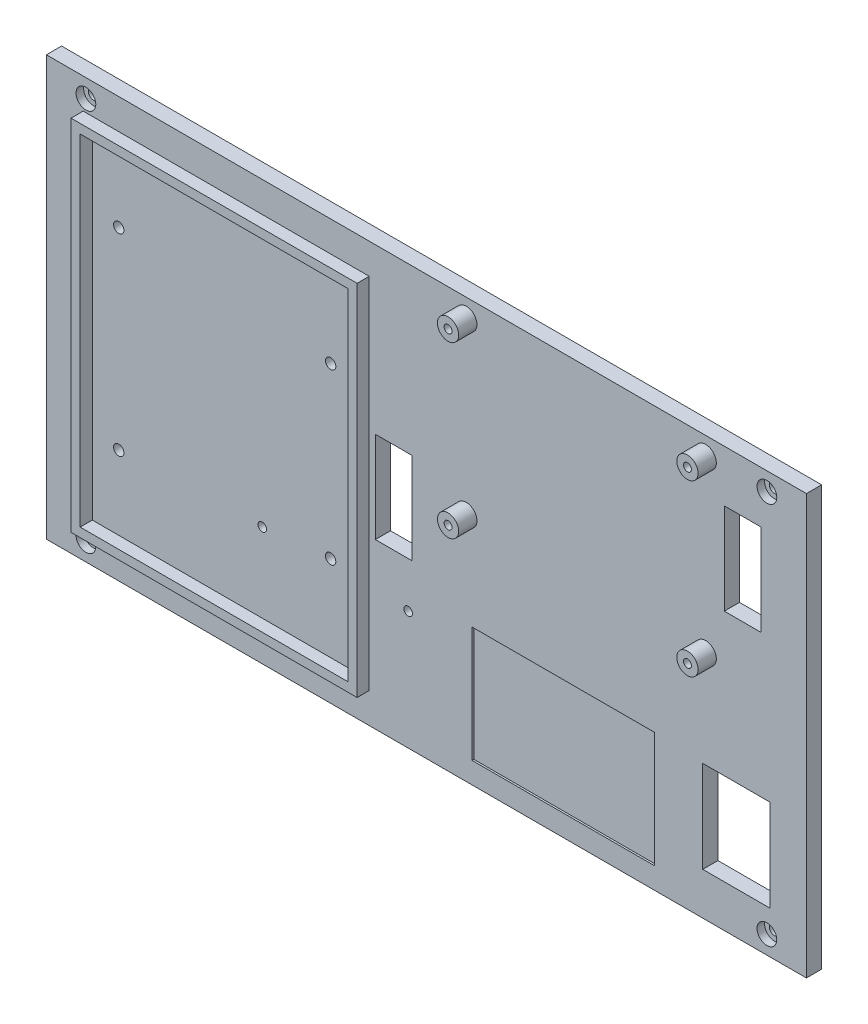
from build123d import *

# Parameters (mm, degrees)
SKETCH1_W                       = 250
SKETCH1_H                       = 138
PLATE_DEPTH                     = 5
SKETCH2_W                       = 94.1
SKETCH2_H                       = 118
SKETCH2_W_2                     = 88.1
SKETCH2_H_2                     = 112
ARM_LOCATING_FENCE_DEPTH        = 4
SKETCH3_R                       = 1.7
ARM_M3_HOLES_DEPTH              = 7
SKETCH4_R                       = 1.7
DECK_M3_HOLES_DEPTH             = 7
SKETCH5_R                       = 3.25
DECK_COUNTERBORES_DEPTH         = 2.5
SKETCH6_W                       = 22.2
SKETCH6_H                       = 30.2
KILL_SWITCH_CUTOUT_DEPTH        = 7
SKETCH7_W                       = 12
SKETCH7_H                       = 30
SERVO_CABLE_SLOT_DEPTH          = 7
SKETCH8_R                       = 1.4
ESP32_STANDOFF_HOLES_M2P5_DEPTH = 7
SKETCH9_R                       = 3.5
MDD10A_BOSSES_DEPTH             = 6
SKETCH10_R                      = 1.3
MDD10A_PILOTS_M3_DEPTH          = 13
SKETCH11_W                      = 12
SKETCH11_H                      = 30
MOTOR_WIRE_SLOT_DEPTH           = 7
SKETCH12_W                      = 60
SKETCH12_H                      = 38
NAME_PLATE_RECESS_DEPTH         = 1.6


with BuildPart() as part:
    # Sketch1 → Plate (new body)
    with BuildSketch(Plane.XY.offset(98)):
        Rectangle(SKETCH1_W, SKETCH1_H)
    extrude(amount=PLATE_DEPTH)

    # Sketch2 → Arm_locating_fence (add)
    with BuildSketch(Plane.XY.offset(103)):
        with Locations((-65.85, 0)):
            Rectangle(SKETCH2_W, SKETCH2_H)
        with Locations((-65.85, 0)):
            Rectangle(SKETCH2_W_2, SKETCH2_H_2, mode=Mode.SUBTRACT)
    extrude(amount=ARM_LOCATING_FENCE_DEPTH)

    # Sketch3 → Arm_M3_holes (cut)
    with BuildSketch(Plane.XY.offset(97)):
        with Locations((-101.2, 31.7)):
            Circle(SKETCH3_R)
        with Locations((-101.2, -31.7)):
            Circle(SKETCH3_R)
        with Locations((-31.5, 27.8)):
            Circle(SKETCH3_R)
        with Locations((-31.5, -27.8)):
            Circle(SKETCH3_R)
    extrude(amount=ARM_M3_HOLES_DEPTH, mode=Mode.SUBTRACT)

    # Sketch4 → Deck_M3_holes (cut)
    with BuildSketch(Plane.XY.offset(97)):
        with Locations((-112, 63)):
            Circle(SKETCH4_R)
        with Locations((-112, -63)):
            Circle(SKETCH4_R)
        with Locations((112, 63)):
            Circle(SKETCH4_R)
        with Locations((112, -63)):
            Circle(SKETCH4_R)
    extrude(amount=DECK_M3_HOLES_DEPTH, mode=Mode.SUBTRACT)

    # Sketch5 → Deck_counterbores (cut)
    with BuildSketch(Plane.XY.offset(103)):
        with Locations((-112, 63)):
            Circle(SKETCH5_R)
        with Locations((-112, -63)):
            Circle(SKETCH5_R)
        with Locations((112, 63)):
            Circle(SKETCH5_R)
        with Locations((112, -63)):
            Circle(SKETCH5_R)
    extrude(amount=-DECK_COUNTERBORES_DEPTH, mode=Mode.SUBTRACT)

    # Sketch6 → Kill_switch_cutout (cut)
    with BuildSketch(Plane.XY.offset(97)):
        with Locations((102, -40)):
            Rectangle(SKETCH6_W, SKETCH6_H)
    extrude(amount=KILL_SWITCH_CUTOUT_DEPTH, mode=Mode.SUBTRACT)

    # Sketch7 → Servo_cable_slot (cut)
    with BuildSketch(Plane.XY.offset(97)):
        with Locations((-10.8, 0)):
            Rectangle(SKETCH7_W, SKETCH7_H)
    extrude(amount=SERVO_CABLE_SLOT_DEPTH, mode=Mode.SUBTRACT)

    # Sketch8 → ESP32_standoff_holes_M2p5 (cut)
    with BuildSketch(Plane.XY.offset(97)):
        with Locations((-6, -30)):
            Circle(SKETCH8_R)
        with Locations((-54, -30)):
            Circle(SKETCH8_R)
    extrude(amount=ESP32_STANDOFF_HOLES_M2P5_DEPTH, mode=Mode.SUBTRACT)

    # Sketch9 → MDD10A_bosses (add)
    with BuildSketch(Plane.XY.offset(103)):
        with Locations((13.13, 7.06)):
            Circle(SKETCH9_R)
        with Locations((13.13, 62.94)):
            Circle(SKETCH9_R)
        with Locations((91.87, 7.06)):
            Circle(SKETCH9_R)
        with Locations((91.87, 62.94)):
            Circle(SKETCH9_R)
    extrude(amount=MDD10A_BOSSES_DEPTH)

    # Sketch10 → MDD10A_pilots_M3 (cut)
    with BuildSketch(Plane.XY.offset(97)):
        with Locations((13.13, 7.06)):
            Circle(SKETCH10_R)
        with Locations((13.13, 62.94)):
            Circle(SKETCH10_R)
        with Locations((91.87, 7.06)):
            Circle(SKETCH10_R)
        with Locations((91.87, 62.94)):
            Circle(SKETCH10_R)
    extrude(amount=MDD10A_PILOTS_M3_DEPTH, mode=Mode.SUBTRACT)

    # Sketch11 → Motor_wire_slot (cut)
    with BuildSketch(Plane.XY.offset(97)):
        with Locations((104, 37)):
            Rectangle(SKETCH11_W, SKETCH11_H)
    extrude(amount=MOTOR_WIRE_SLOT_DEPTH, mode=Mode.SUBTRACT)

    # Sketch12 → Name_plate_recess (cut)
    with BuildSketch(Plane.XY.offset(102.4)):
        with Locations((45, -43)):
            Rectangle(SKETCH12_W, SKETCH12_H)
    extrude(amount=NAME_PLATE_RECESS_DEPTH, mode=Mode.SUBTRACT)


solid = part.part
